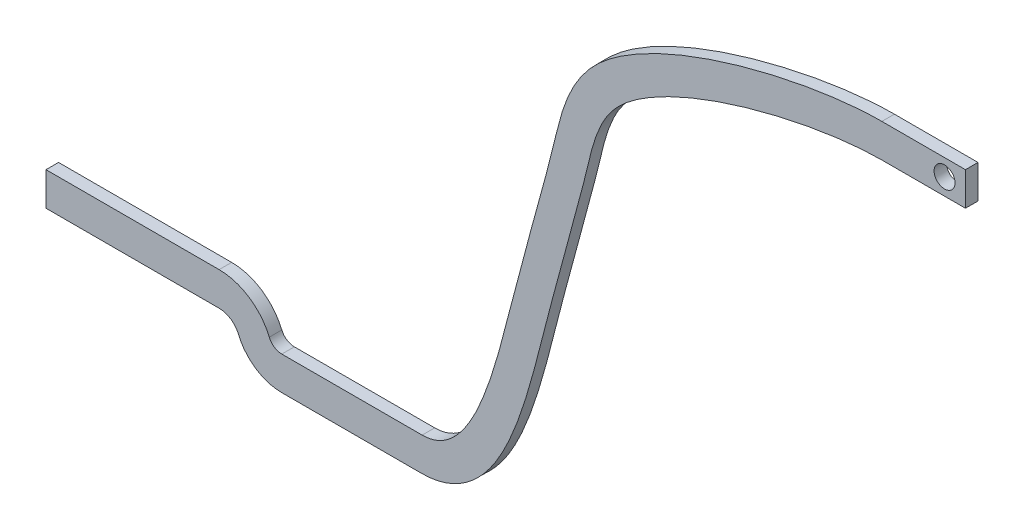
from build123d import *

# Parameters (mm, degrees)
BOSS_EXTRUDE1_DEPTH = 3
SKETCH2_R           = 2.5
CUT_EXTRUDE1_DEPTH  = 3


with BuildPart() as part:
    # Sketch1 → Boss-Extrude1 (new body)
    with BuildSketch(Plane.XY):
        with BuildLine():
            Line((0, 0), (41.424757502, 0))
            ThreePointArc((41.424757502, 0), (48.635860053, -2.183346174), (53.424757502, -8))
            ThreePointArc((53.424757502, -8), (54.621981847, -9.454163435), (56.424757458, -9.999999971))
            Line((56.424757458, -9.999999971), (90, -9.999999971))
            add(Edge.make_bspline(
                [(90, -9.999999971), (101.94321486, -9.999999971), (114.607926466, 42.084483028), (120.208592324, 59.182135041), (128.348937954, 97.097862495), (181.29765762, 110.000004857), (200, 110.000004857)],
                knots=[0, 0, 0, 0, 0.20762714, 0.498806022, 0.661293053, 1, 1, 1, 1], degree=3))
            Line((200, 110.000004857), (220, 110.000004857))
            Line((220, 110.000004857), (220, 102.000004857))
            Line((220, 102.000004857), (200, 102.000004857))
            add(Edge.make_bspline(
                [(89.756838406, -17.999999971), (89.813091795, -17.999999971), (89.902348937, -17.99991601), (90.001850229, -18.000139906), (90.231085956, -17.999171243), (90.472950891, -17.994502467), (90.88414168, -17.980154216), (91.388127875, -17.949084441), (92.194758518, -17.871561419), (93.190450081, -17.72286766), (94.750744822, -17.37818963), (96.618735489, -16.757673538), (99.377089264, -15.423449896), (102.343197714, -13.259068272), (106.174900802, -9.189275061), (109.735071262, -3.386717834), (112.96167459, 4.246438645), (115.514327901, 12.179197087), (117.251666846, 18.629550159), (118.474102134, 23.412205108), (119.602496231, 27.823111881), (120.898538708, 32.792560977), (122.284194923, 38.001312714), (123.94319615, 44.125714587), (125.369626288, 49.290096441), (126.666392795, 54.039664022), (127.597558228, 57.523867483), (128.35823599, 60.470259752), (128.966266022, 62.905422434), (129.429299713, 64.806090196), (129.883035303, 66.712903032), (130.492374677, 69.171023898), (131.670627829, 73.300693044), (133.543133303, 77.497644057), (136.170909387, 80.843401522), (138.117867338, 82.722087773), (140.506133763, 84.680882167), (144.208061636, 87.152729275), (149.590597905, 90.008554504), (155.679808935, 92.658257489), (162.257603089, 95.044400144), (169.111801491, 97.126312165), (176.035239222, 98.873148805), (182.821256282, 100.259557815), (188.187246713, 101.096565943), (192.194993208, 101.566634815), (195.030088806, 101.818031656), (197.217185842, 101.942662864), (198.857928812, 101.991927712), (199.613923387, 102.000004857), (200, 102.000004857)],
                knots=[-0.001409083, -0.001409083, -0.001409083, -0.001409083, -0.000431145, 5.7825e-05, 0.000546794, 0.001524733, 0.002502671, 0.004458548, 0.006414425, 0.01032618, 0.014237934, 0.022061442, 0.029884951, 0.045531968, 0.061178985, 0.092473018, 0.123767052, 0.155061086, 0.18635512, 0.202002137, 0.217649154, 0.248943188, 0.280237222, 0.311531255, 0.374119323, 0.405413357, 0.436707391, 0.468001425, 0.483648442, 0.499295458, 0.514942475, 0.530589492, 0.561883526, 0.624471594, 0.655765628, 0.671412645, 0.687059662, 0.718353695, 0.749647729, 0.780941763, 0.812235797, 0.843529831, 0.874823865, 0.906117898, 0.937411932, 0.953058949, 0.968705966, 0.984352983, 0.992176492, 1, 1, 1, 1], degree=3))
            Line((89.756838406, -17.999999971), (56.424757458, -17.999999971))
            ThreePointArc((56.424757458, -17.999999971), (50.184380277, -16.11056579), (46.040142117, -11.076923077))
            ThreePointArc((46.040142117, -11.076923077), (44.198258483, -8.839748528), (41.424757502, -8))
            Line((41.424757502, -8), (0, -8))
            Line((0, -8), (0, 0))
        make_face()
    extrude(amount=BOSS_EXTRUDE1_DEPTH)

    # Sketch2 → Cut-Extrude1 (cut)
    with BuildSketch(Plane.XY.offset(3)):
        with Locations((215, 106.000004857)):
            Circle(SKETCH2_R)
    extrude(amount=-CUT_EXTRUDE1_DEPTH, mode=Mode.SUBTRACT)


solid = part.part
